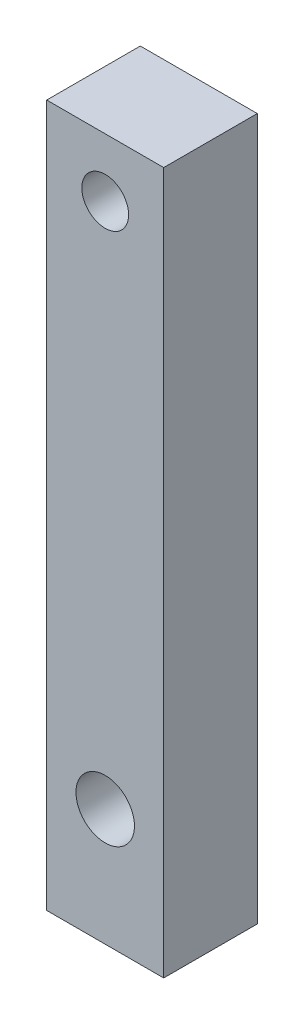
from build123d import *

# Parameters (mm, degrees)
SKETCH_1_W      = 10
SKETCH_1_H      = 60
SKETCH_1_R      = 2
SKETCH_1_R_2    = 2.5
EXTRUDE_1_DEPTH = 8


with BuildPart() as part:
    # 草图1 → 凸台-拉伸1 (new body)
    with BuildSketch(Plane.XY):
        with Locations((1.029411765, -21.194852941)):
            Rectangle(SKETCH_1_W, SKETCH_1_H)
        with Locations((1.029411765, 3.805147059)):
            Circle(SKETCH_1_R, mode=Mode.SUBTRACT)
        with Locations((1.029411765, -41.194852941)):
            Circle(SKETCH_1_R_2, mode=Mode.SUBTRACT)
    extrude(amount=EXTRUDE_1_DEPTH)


solid = part.part
